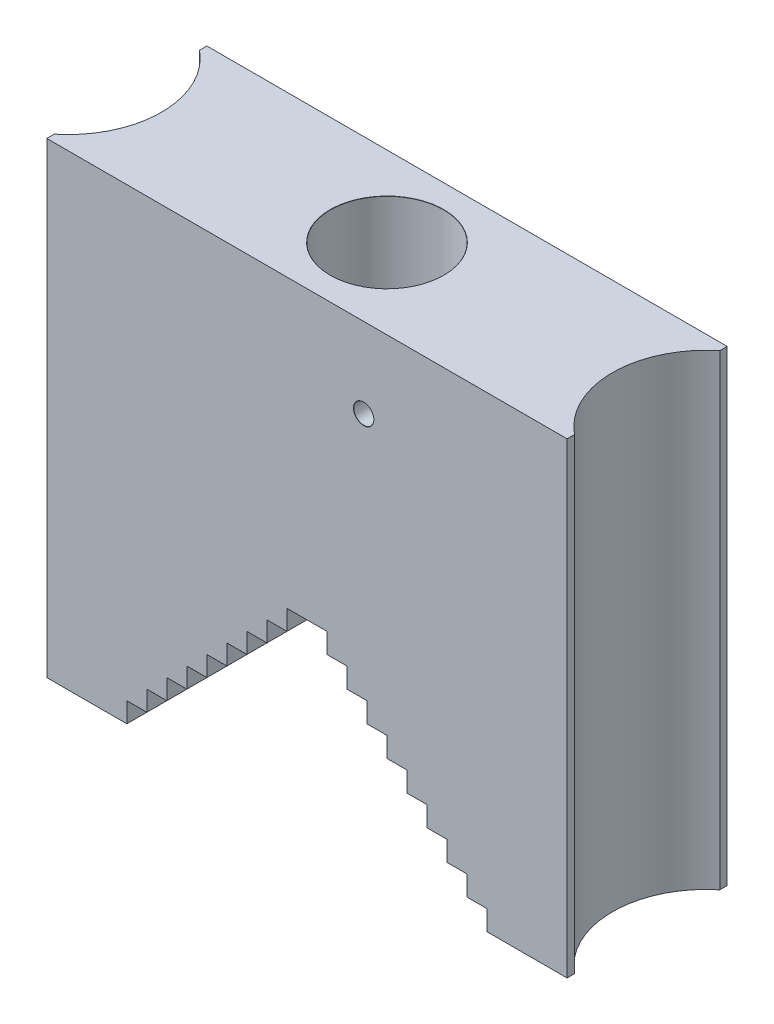
from build123d import *

# Parameters (mm, degrees)
SKETCH1_W                            = 78
SKETCH1_H                            = 70
BOSS_EXTRUDE1_DEPTH                  = 12
F_17_0_17_DIAMETER_HOLE1_D           = 17
F_17_0_17_DIAMETER_HOLE1_DEPTH       = 25
F_17_0_17_DIAMETER_HOLE1_CSINK_D     = 17.05
F_17_0_17_DIAMETER_HOLE1_CSINK_ANGLE = 90
F_17_0_17_DIAMETER_HOLE1_TIP         = 5.107315262
F_3_0_3_DIAMETER_HOLE2_D             = 3
F_3_0_3_DIAMETER_HOLE2_CSINK_D       = 3.05
F_3_0_3_DIAMETER_HOLE2_CSINK_ANGLE   = 90
CUT_EXTRUDE1_REACH                   = 83.025
SKETCH11_R                           = 14
CUT_EXTRUDE2_REACH                   = 59.637


with BuildPart() as part:
    # Sketch1 → Boss-Extrude1 (new, symmetric)
    with BuildSketch(Plane.XY):
        Rectangle(SKETCH1_W, SKETCH1_H)
    extrude(amount=BOSS_EXTRUDE1_DEPTH, both=True)

    # Ø17.0 (17) Diameter Hole1
    with Locations(Plane(origin=(0, 35, 0), x_dir=(1, 0, 0), z_dir=(0, 1, 0))):
        with Locations((0, 0)):
            CounterSinkHole(F_17_0_17_DIAMETER_HOLE1_D / 2, F_17_0_17_DIAMETER_HOLE1_CSINK_D / 2, depth=F_17_0_17_DIAMETER_HOLE1_DEPTH, counter_sink_angle=F_17_0_17_DIAMETER_HOLE1_CSINK_ANGLE)
            with Locations((0, 0, -(F_17_0_17_DIAMETER_HOLE1_DEPTH + F_17_0_17_DIAMETER_HOLE1_TIP / 2))):  # 118° drill point
                Cone(0, F_17_0_17_DIAMETER_HOLE1_D / 2, F_17_0_17_DIAMETER_HOLE1_TIP, mode=Mode.SUBTRACT)

    # Ø3.0 (3) Diameter Hole2 (through all)
    with Locations(Plane.XY.offset(12)):
        with Locations((8.5, 23)):
            CounterSinkHole(F_3_0_3_DIAMETER_HOLE2_D / 2, F_3_0_3_DIAMETER_HOLE2_CSINK_D / 2, counter_sink_angle=F_3_0_3_DIAMETER_HOLE2_CSINK_ANGLE)

    # Sketch11 → Cut-Extrude1 (cut, up to next)
    with BuildSketch(Plane(origin=(0, 35, 0), x_dir=(1, 0, 0), z_dir=(0, 1, 0)), mode=Mode.PRIVATE) as cut_extrude1_sk1:
        with Locations((-47.8, 0)):
            Circle(SKETCH11_R)
    cut_extrude1_tool1 = extrude(cut_extrude1_sk1.sketch, amount=-CUT_EXTRUDE1_REACH, mode=Mode.PRIVATE) & part.part
    # Sketch11 → Cut-Extrude1 (cut, up to next)
    with BuildSketch(Plane(origin=(0, 35, 0), x_dir=(1, 0, 0), z_dir=(0, 1, 0)), mode=Mode.PRIVATE) as cut_extrude1_sk2:
        with Locations((47.8, 0)):
            Circle(SKETCH11_R)
    cut_extrude1_tool2 = extrude(cut_extrude1_sk2.sketch, amount=-CUT_EXTRUDE1_REACH, mode=Mode.PRIVATE) & part.part
    add(cut_extrude1_tool1.solids().sort_by_distance((-47.8, 35, 0))[0], mode=Mode.SUBTRACT)
    add(cut_extrude1_tool2.solids().sort_by_distance((47.8, 35, 0))[0], mode=Mode.SUBTRACT)

    # Sketch12 → Cut-Extrude2 (cut, up to next)
    with BuildSketch(Plane.XY.offset(12), mode=Mode.PRIVATE) as cut_extrude2_sk1:
        Polygon((27, -35), (27, -32), (24, -32), (24, -29), (21, -29), (21, -26), (18, -26), (18, -23), (15, -23), (15, -20), (12, -20), (12, -17), (9, -17), (9, -14), (6, -14), (6, -11), (3, -11), (3, -8), (-3, -8), (-3, -11), (-6, -11), (-6, -14), (-9, -14), (-9, -17), (-12, -17), (-12, -20), (-15, -20), (-15, -23), (-18, -23), (-18, -26), (-21, -26), (-21, -29), (-24, -29), (-24, -32), (-27, -32), (-27, -35), align=None)
    cut_extrude2_tool1 = extrude(cut_extrude2_sk1.sketch, amount=-CUT_EXTRUDE2_REACH, mode=Mode.PRIVATE) & part.part
    add(cut_extrude2_tool1.solids().sort_by_distance((0, -25.5, 12))[0], mode=Mode.SUBTRACT)


solid = part.part
